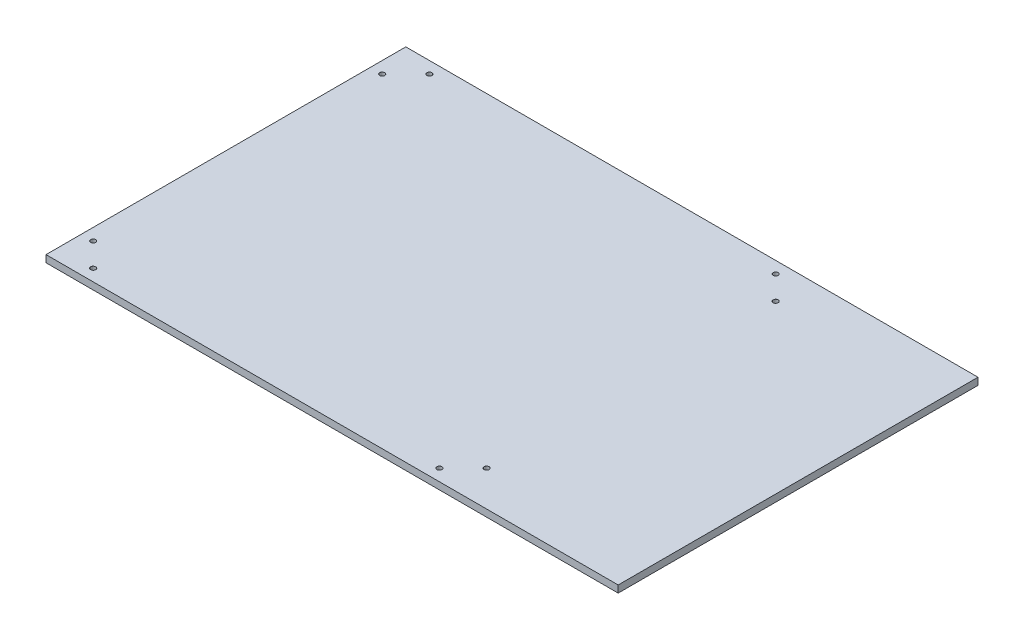
from build123d import *

# Parameters (mm, degrees)
SKETCH1_W                          = 970
SKETCH1_H                          = 610
BOSS_EXTRUDE1_DEPTH                = 12
SKETCH2_R                          = 4.233877047
CUT_EXTRUDE1_DEPTH                 = 10
TAP_DRILL_FOR_M10_TAP1_D           = 8.5
TAP_DRILL_FOR_M10_TAP1_CSINK_D     = 8.55
TAP_DRILL_FOR_M10_TAP1_CSINK_ANGLE = 90


with BuildPart() as part:
    # Sketch1 → Boss-Extrude1 (new body)
    with BuildSketch(Plane(origin=(0, 0, 0), x_dir=(1, 0, 0), z_dir=(0, 1, 0))):
        with Locations((-192.306733167, 56.633416459)):
            Rectangle(SKETCH1_W, SKETCH1_H)
    extrude(amount=BOSS_EXTRUDE1_DEPTH)

    # Sketch2 → Cut-Extrude1 (cut)
    with BuildSketch(Plane(origin=(0, 12, 0), x_dir=(1, 0, 0), z_dir=(0, 1, 0))):
        with Locations(Location((-30.29537408, 341.621974399, 0), (0, 0, 270))):
            Circle(SKETCH2_R)
    extrude(amount=-CUT_EXTRUDE1_DEPTH, mode=Mode.SUBTRACT)

    # Tap Drill for M10 Tap1 (through all)
    with Locations(Plane(origin=(0, 12, 0), x_dir=(1, 0, 0), z_dir=(0, 1, 0))):
        with Locations((-617.306733167, 341.633416459), (-657.306733167, 301.633416459), (-617.306733167, -228.366583541), (-657.306733167, -188.366583541), (9.693266833, -188.366583541), (-30.306733167, -228.366583569), (9.693266833, 301.633416459)):
            CounterSinkHole(TAP_DRILL_FOR_M10_TAP1_D / 2, TAP_DRILL_FOR_M10_TAP1_CSINK_D / 2, counter_sink_angle=TAP_DRILL_FOR_M10_TAP1_CSINK_ANGLE)


solid = part.part
